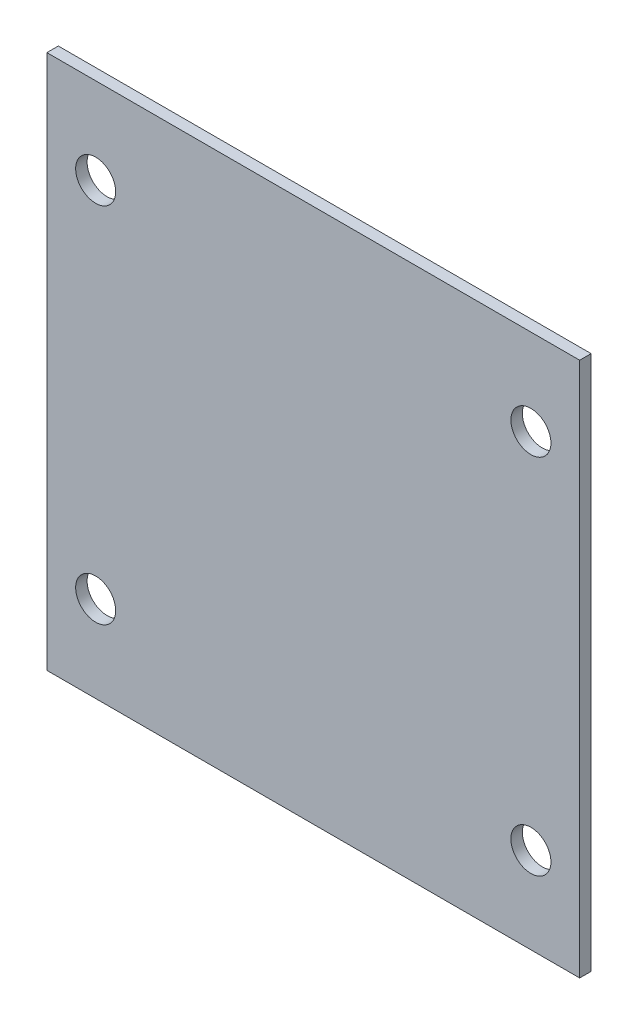
from build123d import *

# Parameters (mm, degrees)
SKETCH1_W           = 46.594816482
SKETCH1_H           = 46.788961552
SKETCH1_R           = 1.75
BOSS_EXTRUDE1_DEPTH = 1


with BuildPart() as part:
    # Sketch1 → Boss-Extrude1 (new body)
    with BuildSketch(Plane.XY):
        Rectangle(SKETCH1_W, SKETCH1_H)
        with Locations((-19.031519272, 15.862695549)):
            Circle(SKETCH1_R, mode=Mode.SUBTRACT)
        with Locations((19.031519272, 15.862695549)):
            Circle(SKETCH1_R, mode=Mode.SUBTRACT)
        with Locations((19.031519272, -15.862695549)):
            Circle(SKETCH1_R, mode=Mode.SUBTRACT)
        with Locations((-19.031519272, -15.862695549)):
            Circle(SKETCH1_R, mode=Mode.SUBTRACT)
    extrude(amount=BOSS_EXTRUDE1_DEPTH)


solid = part.part
